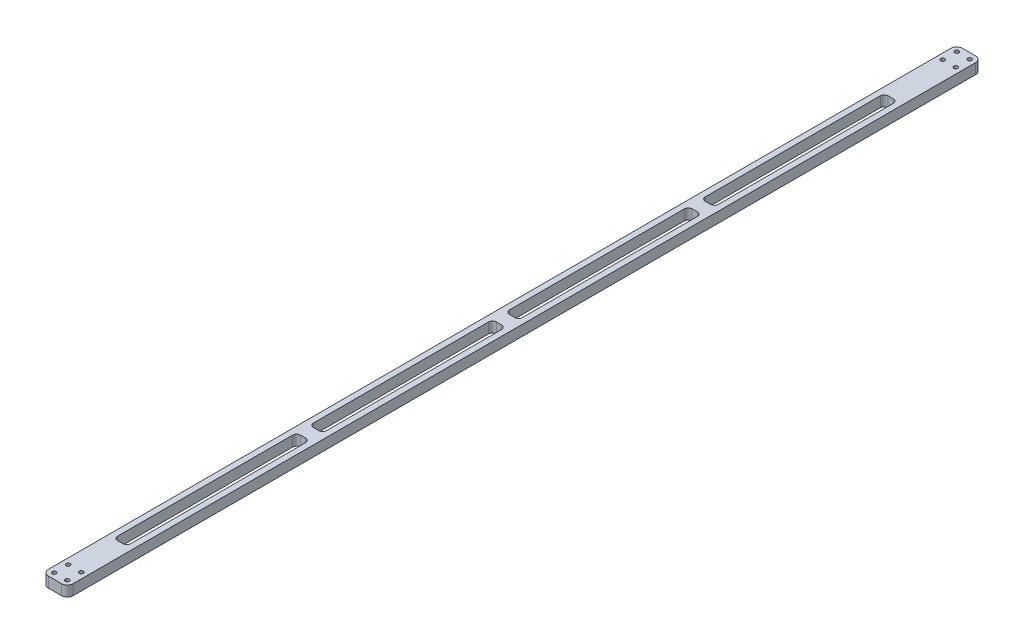
from build123d import *

# Parameters (mm, degrees)
SKETCH_1_R          = 1.5
EXTRUDE_1_DEPTH     = 8
CUT_EXTRUDE_2_DEPTH = 701.303505632


with BuildPart() as part:
    # 草图1 → 凸台-拉伸1 (new body)
    with BuildSketch(Plane(origin=(0, 0, 0), x_dir=(1, 0, 0), z_dir=(0, 1, 0))):
        with BuildLine():
            Line((4.5, 0), (14.5, 0))
            ThreePointArc((14.5, 0), (17.681980515, 1.318019485), (19, 4.5))
            Line((19, 4.5), (19, 695.5))
            ThreePointArc((19, 695.5), (17.681980515, 698.681980515), (14.5, 700))
            Line((14.5, 700), (4.5, 700))
            ThreePointArc((4.5, 700), (1.318019485, 698.681980515), (0, 695.5))
            Line((0, 695.5), (0, 4.5))
            ThreePointArc((0, 4.5), (1.318019485, 1.318019485), (4.5, 0))
        make_face()
        with Locations(Location((4.5, 4.5, 0), (0, 0, 270))):
            Circle(SKETCH_1_R, mode=Mode.SUBTRACT)
        with Locations(Location((14.5, 4.5, 0), (0, 0, 270))):
            Circle(SKETCH_1_R, mode=Mode.SUBTRACT)
        with Locations(Location((4.5, 15.08659859, 0), (0, 0, 270))):
            Circle(SKETCH_1_R, mode=Mode.SUBTRACT)
        with Locations(Location((14.5, 15.08659859, 0), (0, 0, 270))):
            Circle(SKETCH_1_R, mode=Mode.SUBTRACT)
        with Locations(Location((14.5, 684.91340141, 0), (0, 0, 90))):
            Circle(SKETCH_1_R, mode=Mode.SUBTRACT)
        with Locations(Location((4.5, 684.91340141, 0), (0, 0, 90))):
            Circle(SKETCH_1_R, mode=Mode.SUBTRACT)
        with Locations(Location((14.5, 695.5, 0), (0, 0, 90))):
            Circle(SKETCH_1_R, mode=Mode.SUBTRACT)
        with Locations(Location((4.5, 695.5, 0), (0, 0, 90))):
            Circle(SKETCH_1_R, mode=Mode.SUBTRACT)
    extrude(amount=EXTRUDE_1_DEPTH)

    # 草图5 → 切除-拉伸2 (cut, through all)
    with BuildSketch(Plane(origin=(0, 8, 0), x_dir=(1, 0, 0), z_dir=(0, 1, 0))):
        with BuildLine():
            Line((7.5, 50), (11.5, 50))
            ThreePointArc((11.5, 50), (13.621320344, 50.878679656), (14.5, 53))
            Line((14.5, 53), (14.5, 187))
            ThreePointArc((14.5, 187), (13.621320344, 189.121320344), (11.5, 190))
            Line((11.5, 190), (7.5, 190))
            ThreePointArc((7.5, 190), (5.378679656, 189.121320344), (4.5, 187))
            Line((4.5, 187), (4.5, 53))
            ThreePointArc((4.5, 53), (5.378679656, 50.878679656), (7.5, 50))
        make_face()
        with BuildLine():
            Line((14.5, 203), (14.5, 337))
            ThreePointArc((14.5, 337), (13.621320344, 339.121320344), (11.5, 340))
            Line((11.5, 340), (7.5, 340))
            ThreePointArc((7.5, 340), (5.378679656, 339.121320344), (4.5, 337))
            Line((4.5, 337), (4.5, 203))
            ThreePointArc((4.5, 203), (5.378679656, 200.878679656), (7.5, 200))
            Line((7.5, 200), (11.5, 200))
            ThreePointArc((11.5, 200), (13.621320344, 200.878679656), (14.5, 203))
        make_face()
        with BuildLine():
            Line((14.5, 353), (14.5, 487))
            ThreePointArc((14.5, 487), (13.621320344, 489.121320344), (11.5, 490))
            Line((11.5, 490), (7.5, 490))
            ThreePointArc((7.5, 490), (5.378679656, 489.121320344), (4.5, 487))
            Line((4.5, 487), (4.5, 353))
            ThreePointArc((4.5, 353), (5.378679656, 350.878679656), (7.5, 350))
            Line((7.5, 350), (11.5, 350))
            ThreePointArc((11.5, 350), (13.621320344, 350.878679656), (14.5, 353))
        make_face()
        with BuildLine():
            Line((14.5, 503), (14.5, 637))
            ThreePointArc((14.5, 637), (13.621320344, 639.121320344), (11.5, 640))
            Line((11.5, 640), (7.5, 640))
            ThreePointArc((7.5, 640), (5.378679656, 639.121320344), (4.5, 637))
            Line((4.5, 637), (4.5, 503))
            ThreePointArc((4.5, 503), (5.378679656, 500.878679656), (7.5, 500))
            Line((7.5, 500), (11.5, 500))
            ThreePointArc((11.5, 500), (13.621320344, 500.878679656), (14.5, 503))
        make_face()
    extrude(amount=-CUT_EXTRUDE_2_DEPTH, mode=Mode.SUBTRACT)


solid = part.part
